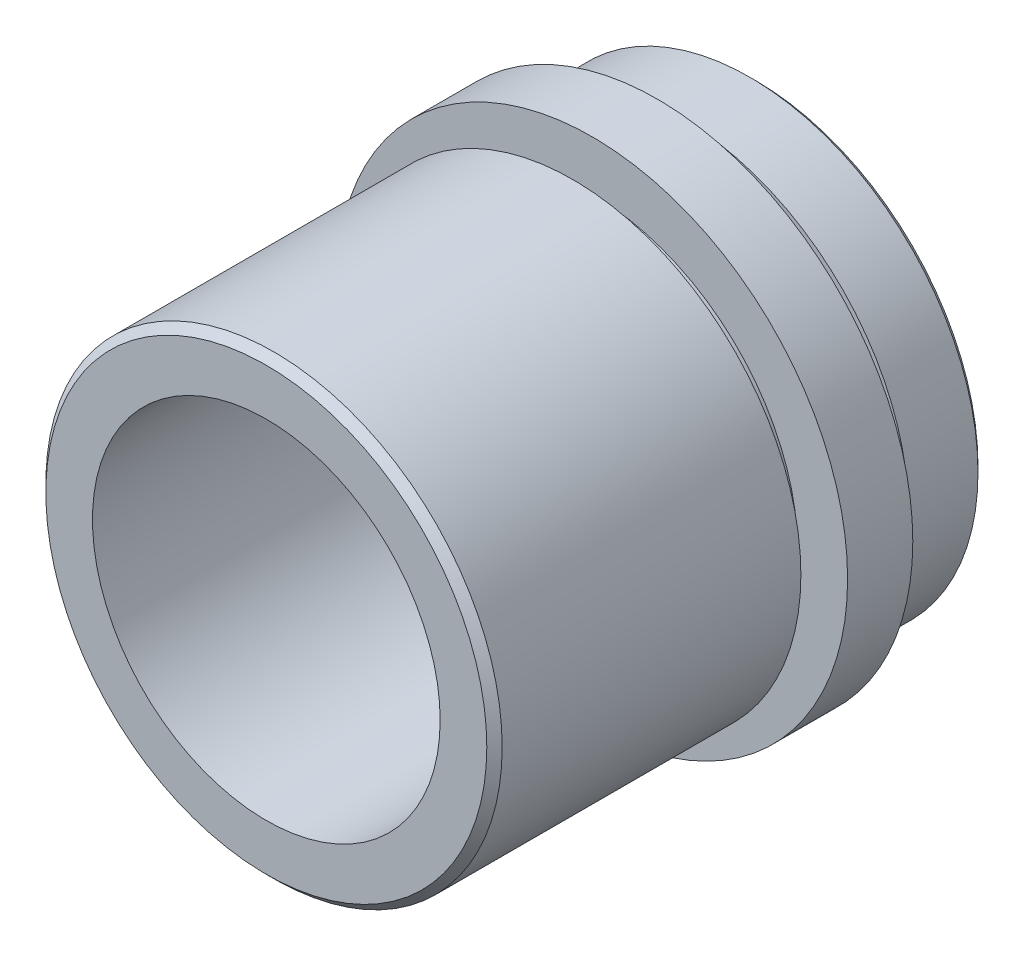
from build123d import *

# Parameters (mm, degrees)
SZKIC1_W = 6
SZKIC1_H = 23.5
SZKIC2_W = 30
SZKIC2_H = 21
SZKIC4_W = 1.8
SZKIC4_H = 2.1
SZKIC5_W = 9
SZKIC5_H = 21
SZKIC8_W = 2.1
SZKIC8_H = 2.1


with BuildPart() as part:
    # Szkic1 → Obrót1 (revolve)
    with BuildSketch(Plane(origin=(0, 0, 0), x_dir=(0, 0, -1), z_dir=(1, 0, 0))):
        with Locations((-12, 11.75)):
            Rectangle(SZKIC1_W, SZKIC1_H)
    revolve(axis=Axis((0, 0, 9), (0, 0, 1)))

    # Szkic2 → Obrót2 (revolve)
    with BuildSketch(Plane(origin=(0, 0, 0), x_dir=(0, 0, -1), z_dir=(1, 0, 0))):
        with Locations((-30, 10.5)):
            Rectangle(SZKIC2_W, SZKIC2_H)
    revolve(axis=Axis((0, 0, 15), (0, 0, 1)))

    # Szkic3 → Wycięcie-obrót1 (revolve, cut)
    with BuildSketch(Plane(origin=(0, 0, 0), x_dir=(0, 0, -1), z_dir=(1, 0, 0))):
        Polygon((-45, 20.292893219), (-44.292893219, 21), (-45, 21), align=None)
    revolve(axis=Axis((0, 0, 15), (0, 0, 1)), mode=Mode.SUBTRACT)

    # Szkic4 → Wycięcie-obrót2 (revolve, cut)
    with BuildSketch(Plane(origin=(0, 0, 0), x_dir=(0, 0, -1), z_dir=(1, 0, 0))):
        with Locations((-15.9, 19.95)):
            Rectangle(SZKIC4_W, SZKIC4_H)
    revolve(axis=Axis((0, 0, 15), (0, 0, 1)), mode=Mode.SUBTRACT)

    # Szkic5 → Obrót3 (revolve)
    with BuildSketch(Plane(origin=(0, 0, 0), x_dir=(0, 0, -1), z_dir=(1, 0, 0))):
        with Locations((-4.5, 10.5)):
            Rectangle(SZKIC5_W, SZKIC5_H)
    revolve(axis=Axis((0, 0, 0), (0, 0, 1)))

    # Szkic6 → Wycięcie-obrót3 (revolve, cut)
    with BuildSketch(Plane(origin=(0, 0, 0), x_dir=(0, 0, -1), z_dir=(1, 0, 0))):
        Polygon((-45, 0), (-45, 16), (-1, 16), (0, 17), (0, 0), align=None)
    revolve(axis=Axis((0, 0, 0), (0, 0, 1)), mode=Mode.SUBTRACT)

    # Szkic7 → Wycięcie-obrót4 (revolve, cut)
    with BuildSketch(Plane(origin=(0, 0, 0), x_dir=(0, 0, -1), z_dir=(1, 0, 0))):
        Polygon((-0.5, 21), (0, 20.5), (0, 21), align=None)
    revolve(axis=Axis((0, 0, 0), (0, 0, 1)), mode=Mode.SUBTRACT)

    # Szkic8 → Wycięcie-obrót5 (revolve, cut)
    with BuildSketch(Plane(origin=(0, 0, 0), x_dir=(0, 0, -1), z_dir=(1, 0, 0))):
        with Locations((-7.95, 19.95)):
            Rectangle(SZKIC8_W, SZKIC8_H)
    revolve(axis=Axis((0, 0, 0), (0, 0, 1)), mode=Mode.SUBTRACT)


solid = part.part
